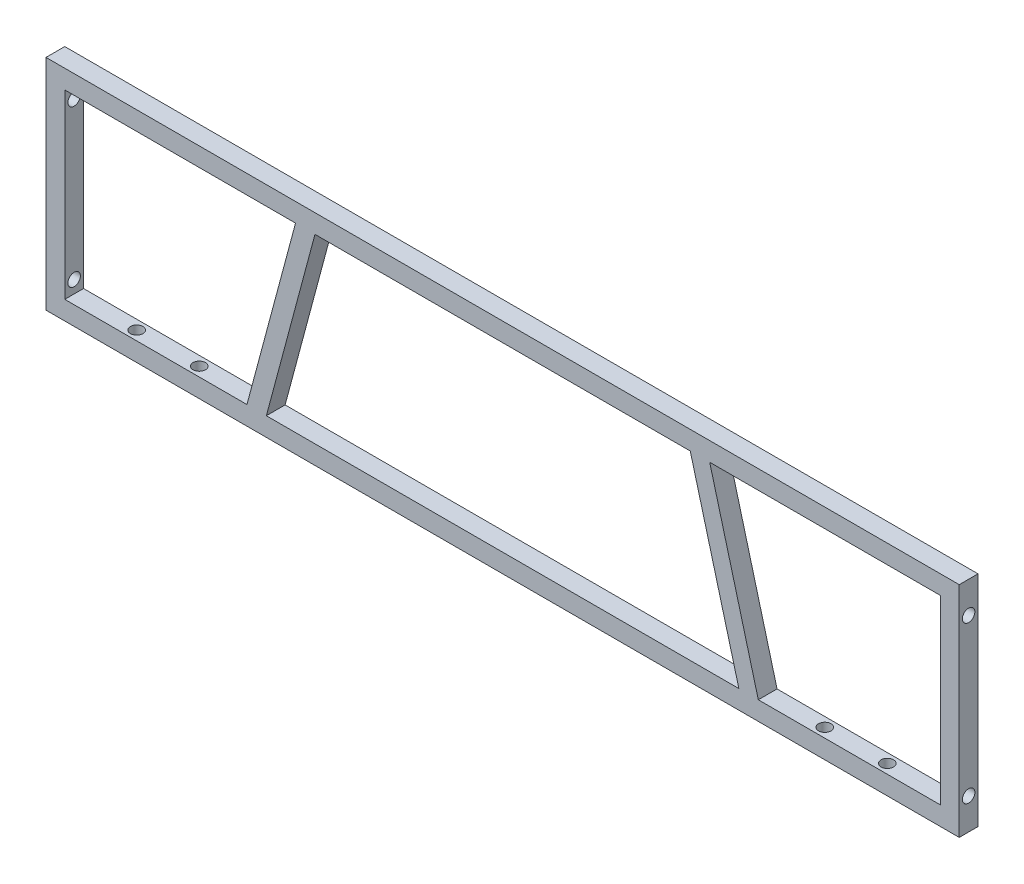
from build123d import *

# Parameters (mm, degrees)
SKETCH_1_W          = 292
SKETCH_1_H          = 70
SKETCH_1_W_2        = 280
SKETCH_1_H_2        = 58
EXTRUDE_1_DEPTH     = 6
EXTRUDE_2_DEPTH     = 6
SKETCH_3_R          = 2
CUT_EXTRUDE_1_DEPTH = 6
SKETCH_4_R          = 2
CUT_EXTRUDE_2_DEPTH = 6


with BuildPart() as part:
    # 草图1 → 凸台-拉伸1 (new body)
    with BuildSketch(Plane.XY):
        Rectangle(SKETCH_1_W, SKETCH_1_H)
        Rectangle(SKETCH_1_W_2, SKETCH_1_H_2, mode=Mode.SUBTRACT)
    extrude(amount=EXTRUDE_1_DEPTH)

    # 草图2 → 凸台-拉伸2 (add)
    with BuildSketch(Plane.XY):
        Polygon((-78.646881702, -29), (-81.752710243, -29), (-66.211657082, 29), (-60, 29), (-75.541053161, -29), align=None)
        Polygon((75.541053161, -29), (78.646881702, -29), (81.752710243, -29), (66.211657082, 29), (60, 29), align=None)
    extrude(amount=EXTRUDE_2_DEPTH)

    # 草图3 → 切除-拉伸1 (cut)
    with BuildSketch(Plane.ZY.offset(146)):
        with Locations((3, 25)):
            Circle(SKETCH_3_R)
        with Locations((3, -25)):
            Circle(SKETCH_3_R)
    cut_extrude_1 = extrude(amount=-CUT_EXTRUDE_1_DEPTH, mode=Mode.SUBTRACT)

    # 镜向1: 切除-拉伸1 across plane
    add(cut_extrude_1.mirror(Plane(origin=(0, 0, 0), x_dir=(0, 0, 1), z_dir=(1, 0, 0))), mode=Mode.SUBTRACT)

    # 草图4 → 切除-拉伸2 (cut)
    with BuildSketch(Plane.XZ.offset(35)):
        with Locations(Location((-120, 3, 0), (0, 0, 270))):
            Circle(SKETCH_4_R)
        with Locations(Location((-100, 3, 0), (0, 0, 270))):
            Circle(SKETCH_4_R)
        with Locations(Location((120, 3, 0), (0, 0, 90))):
            Circle(SKETCH_4_R)
        with Locations(Location((100, 3, 0), (0, 0, 90))):
            Circle(SKETCH_4_R)
    extrude(amount=-CUT_EXTRUDE_2_DEPTH, mode=Mode.SUBTRACT)


solid = part.part
